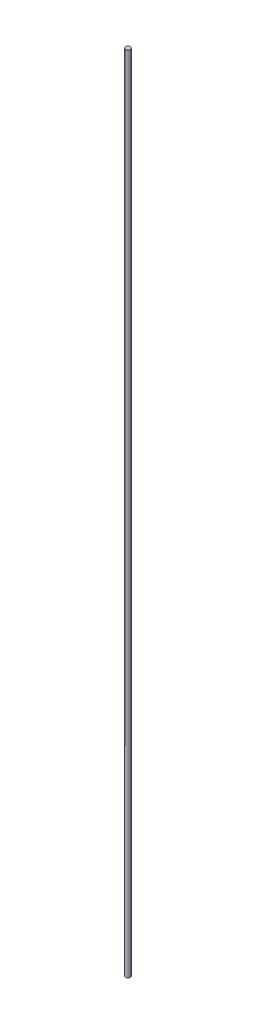
from build123d import *

# Parameters (mm, degrees)
SKETCH1_R           = 6
BOSS_EXTRUDE1_DEPTH = 2000


with BuildPart() as part:
    # Sketch1 → Boss-Extrude1 (new body)
    with BuildSketch(Plane(origin=(0, 0, 0), x_dir=(1, 0, 0), z_dir=(0, 1, 0))):
        with Locations(Location((0, 0, 0), (0, 0, 270))):
            Circle(SKETCH1_R)
    extrude(amount=BOSS_EXTRUDE1_DEPTH)


solid = part.part
